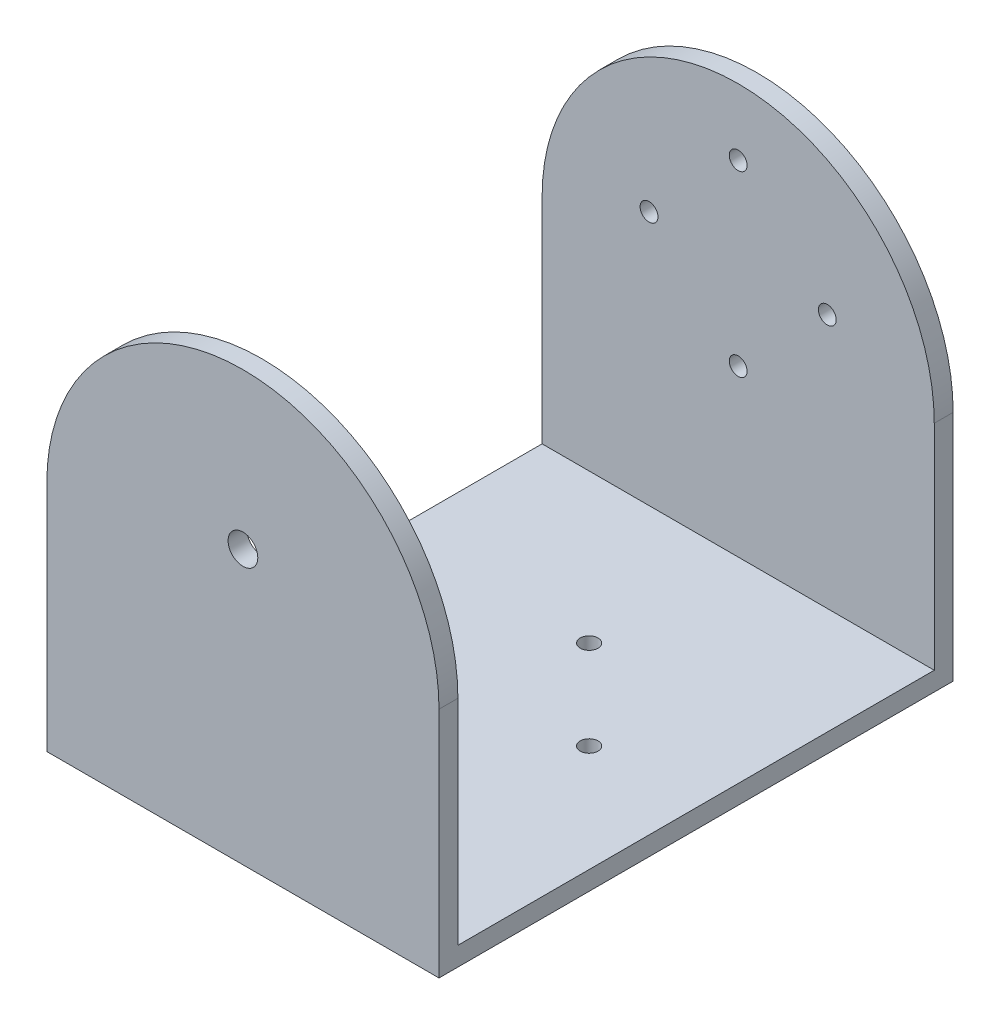
from build123d import *

# Parameters (mm, degrees)
SKETCH1_W           = 33
SKETCH1_H           = 43.264
SKETCH1_R           = 0.75
BOSS_EXTRUDE1_DEPTH = 1.59
SKETCH2_W           = 33
SKETCH2_H           = 1.59
BOSS_EXTRUDE2_DEPTH = 18
BOSS_EXTRUDE3_DEPTH = 1.59
BOSS_EXTRUDE4_START = -1.59
BOSS_EXTRUDE4_DEPTH = 1.59
SKETCH5_R           = 1.25
CUT_EXTRUDE1_DEPTH  = 6
SKETCH6_R           = 0.75
CUT_EXTRUDE2_DEPTH  = 6


with BuildPart() as part:
    # Sketch1 → Boss-Extrude1 (new body)
    with BuildSketch(Plane(origin=(0, 0, 0), x_dir=(1, 0, 0), z_dir=(0, 1, 0))):
        Rectangle(SKETCH1_W, SKETCH1_H)
        with Locations(Location((0, 7.5, 0), (0, 0, 90))):
            Circle(SKETCH1_R, mode=Mode.SUBTRACT)
        with Locations(Location((0, -7.5, 0), (0, 0, 90))):
            Circle(SKETCH1_R, mode=Mode.SUBTRACT)
        with Locations(Location((7.5, 0, 0), (0, 0, 90))):
            Circle(SKETCH1_R, mode=Mode.SUBTRACT)
        with Locations(Location((-7.5, 0, 0), (0, 0, 90))):
            Circle(SKETCH1_R, mode=Mode.SUBTRACT)
    extrude(amount=BOSS_EXTRUDE1_DEPTH)

    # Sketch2 → Boss-Extrude2 (add)
    with BuildSketch(Plane(origin=(0, 1.59, 0), x_dir=(1, 0, 0), z_dir=(0, 1, 0))):
        with Locations((0, 20.837)):
            Rectangle(SKETCH2_W, SKETCH2_H)
        with Locations((0, -20.837)):
            Rectangle(SKETCH2_W, SKETCH2_H)
    extrude(amount=BOSS_EXTRUDE2_DEPTH)

    # Sketch3 → Boss-Extrude3 (add)
    with BuildSketch(Plane.XY.offset(21.632)):
        with BuildLine():
            Line((-16.5, 19.59), (16.5, 19.59))
            ThreePointArc((16.5, 19.59), (0, 36.09), (-16.5, 19.59))
        make_face()
    extrude(amount=-BOSS_EXTRUDE3_DEPTH)

    # Sketch4 → Boss-Extrude4 (add)
    with BuildSketch(Plane(origin=(0, 0, -21.632), x_dir=(-1, 0, 0), z_dir=(0, 0, -1)).offset(BOSS_EXTRUDE4_START)):
        with BuildLine():
            Line((-16.5, 19.59), (16.5, 19.59))
            ThreePointArc((16.5, 19.59), (0, 36.09), (-16.5, 19.59))
        make_face()
    extrude(amount=BOSS_EXTRUDE4_DEPTH)

    # Sketch5 → Cut-Extrude1 (cut)
    with BuildSketch(Plane.XY.offset(21.632)):
        with Locations((0, 23)):
            Circle(SKETCH5_R)
    extrude(amount=-CUT_EXTRUDE1_DEPTH, mode=Mode.SUBTRACT)

    # Sketch6 → Cut-Extrude2 (cut)
    with BuildSketch(Plane(origin=(0, 0, -21.632), x_dir=(-1, 0, 0), z_dir=(0, 0, -1))):
        with Locations((0, 30.5)):
            Circle(SKETCH6_R)
        with Locations((0, 15.5)):
            Circle(SKETCH6_R)
        with Locations((7.5, 23)):
            Circle(SKETCH6_R)
        with Locations((-7.5, 23)):
            Circle(SKETCH6_R)
    extrude(amount=-CUT_EXTRUDE2_DEPTH, mode=Mode.SUBTRACT)


solid = part.part
